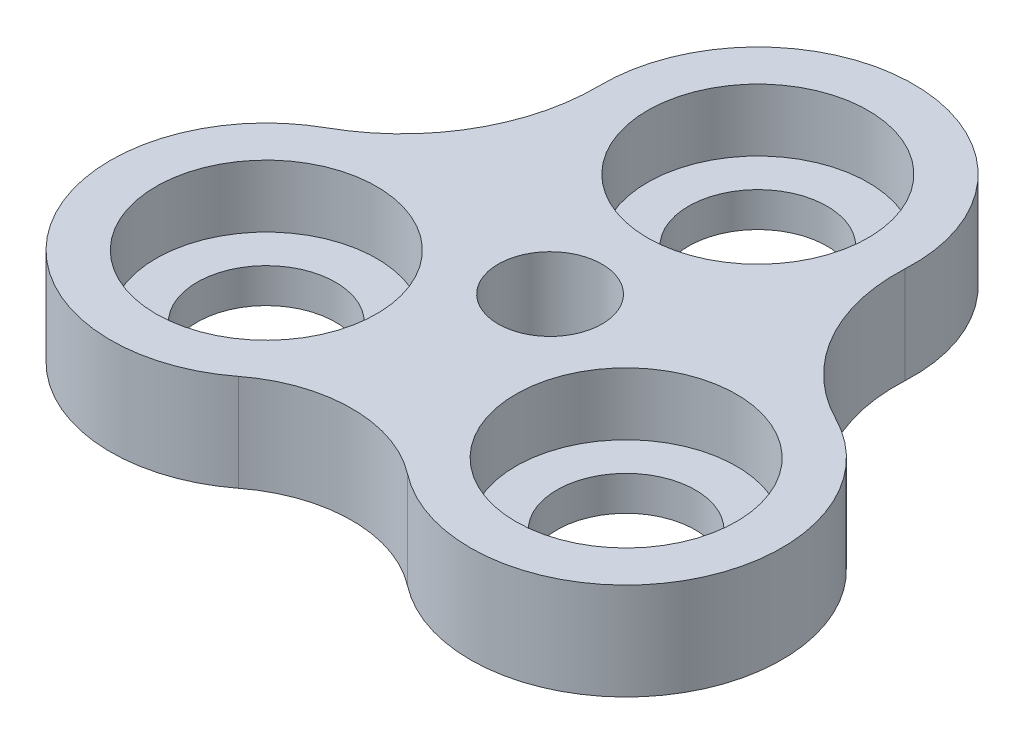
from build123d import *

# Parameters (mm, degrees)
SKETCH1_R           = 3
SKETCH1_R_2         = 6.375
BOSS_EXTRUDE1_DEPTH = 5.6
SKETCH2_R           = 6.375
CUT_EXTRUDE1_DEPTH  = 3.6
SKETCH3_R           = 4
CUT_EXTRUDE2_DEPTH  = 29.810093495


with BuildPart() as part:
    # Sketch1 → Boss-Extrude1 (new body)
    # profile 1 of 4: a face of its own
    with BuildSketch(Plane(origin=(0, 0, 0), x_dir=(1, 0, 0), z_dir=(0, 1, 0))):
        with BuildLine():
            ThreePointArc((-14.775889156, 1.860291889), (-17.90204805, -10.960217435), (-4.883341128, -13.116973989))
            ThreePointArc((-4.883341128, -13.116973989), (0, -11.447792844), (4.883341128, -13.116973989))
            ThreePointArc((4.883341128, -13.116973989), (17.993886057, -10.818294624), (14.477584826, 2.019381989))
            ThreePointArc((14.477584826, 2.019381989), (10.324072295, 5.960605919), (8.987628515, 11.52826525))
            ThreePointArc((8.987628515, 11.52826525), (0.169037816, 20.998412428), (-8.999004613, 11.866149428))
            ThreePointArc((-8.999004613, 11.866149428), (-10.506960828, 6.066196663), (-14.775889156, 1.860291889))
        make_face()
        with Locations(Location((0, 0, 0), (0, 0, 270))):
            Circle(SKETCH1_R, mode=Mode.SUBTRACT)
        with Locations((0, 12)):
            Circle(SKETCH1_R_2, mode=Mode.SUBTRACT)
        with Locations((10.392304845, -6)):
            Circle(SKETCH1_R_2, mode=Mode.SUBTRACT)
        with Locations((-10.392304845, -6)):
            Circle(SKETCH1_R_2, mode=Mode.SUBTRACT)
    # profile 2 of 4: a face of its own
    with BuildSketch(Plane(origin=(0, 0, 0), x_dir=(1, 0, 0), z_dir=(0, 1, 0))):
        with Locations((0, 12)):
            Circle(SKETCH1_R_2)
    # profile 3 of 4: a face of its own
    with BuildSketch(Plane(origin=(0, 0, 0), x_dir=(1, 0, 0), z_dir=(0, 1, 0))):
        with Locations((10.392304845, -6)):
            Circle(SKETCH1_R_2)
    # profile 4 of 4: a face of its own
    with BuildSketch(Plane(origin=(0, 0, 0), x_dir=(1, 0, 0), z_dir=(0, 1, 0))):
        with Locations((-10.392304845, -6)):
            Circle(SKETCH1_R_2)
    extrude(amount=BOSS_EXTRUDE1_DEPTH)

    # Sketch2 → Cut-Extrude1 (cut)
    with BuildSketch(Plane(origin=(0, 5.6, 0), x_dir=(1, 0, 0), z_dir=(0, 1, 0))):
        with Locations(Location((-10.392304845, -6, 0), (0, 0, 270))):
            Circle(SKETCH2_R)
        with Locations(Location((0, 12, 0), (0, 0, 270))):
            Circle(SKETCH2_R)
        with Locations(Location((10.392304845, -6, 0), (0, 0, 270))):
            Circle(SKETCH2_R)
    extrude(amount=-CUT_EXTRUDE1_DEPTH, mode=Mode.SUBTRACT)

    # Sketch3 → Cut-Extrude2 (cut, through all)
    with BuildSketch(Plane(origin=(0, 2, 0), x_dir=(1, 0, 0), z_dir=(0, 1, 0))):
        with Locations(Location((-10.392304845, -6, 0), (0, 0, 270))):
            Circle(SKETCH3_R)
        with Locations(Location((0, 12, 0), (0, 0, 270))):
            Circle(SKETCH3_R)
        with Locations(Location((10.392304845, -6, 0), (0, 0, 270))):
            Circle(SKETCH3_R)
    extrude(amount=-CUT_EXTRUDE2_DEPTH, mode=Mode.SUBTRACT)


solid = part.part
